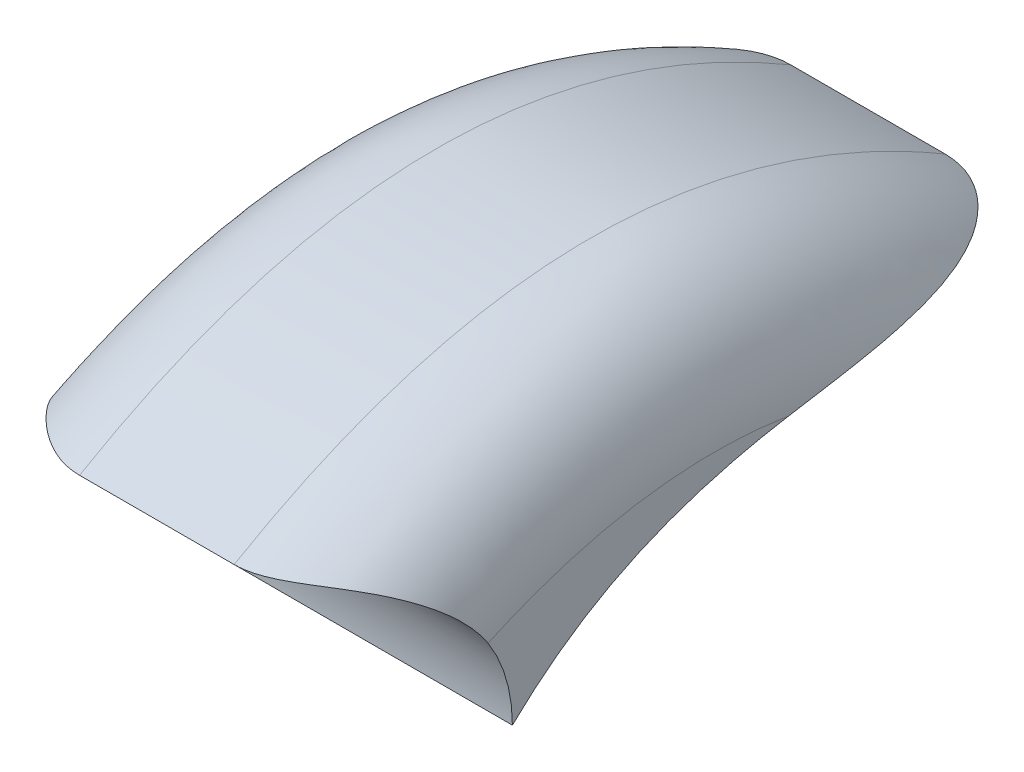
from build123d import *

# Parameters (mm, degrees)
BOSS_EXTRUDE1_DEPTH = 33.02
FILLET1_R           = 10.16
SHELL1_T            = -5.08


with BuildPart() as part:
    # Sketch2 → Boss-Extrude1 (new body)
    with BuildSketch(Plane(origin=(0, 0, 0), x_dir=(0, 0, -1), z_dir=(1, 0, 0))):
        with BuildLine():
            ThreePointArc((12.7, 0), (8.980256121, 8.980256121), (0, 12.7))
            add(Edge.make_bspline(
                [(0, 12.7), (29.28989783, 29.892576061), (58.42, 12.7)],
                knots=[0, 0, 0, 1, 1, 1], degree=2))
            add(Edge.make_bspline(
                [(12.7, 0), (25.477511931, 12.441467843), (42.2764117, 11.221183502), (58.42, 12.7)],
                knots=[0, 0, 0, 0, 1, 1, 1, 1], degree=3))
        make_face()
    extrude(amount=BOSS_EXTRUDE1_DEPTH)

    # Fillet1
    fillet1_edges = [part.edges().sort_by_distance(p)[0] for p in [
        (0, 21.296274247, -29.212962246),
        (33.02, 21.296274247, -29.212962246),
    ]]
    fillet(fillet1_edges, radius=FILLET1_R)

    # Shell1
    shell1_openings = [part.faces().sort_by_distance(p)[0] for p in [
        (16.287107989, 6.283816926, -34.768278498),
    ]]
    offset(amount=SHELL1_T, openings=shell1_openings)


solid = part.part
